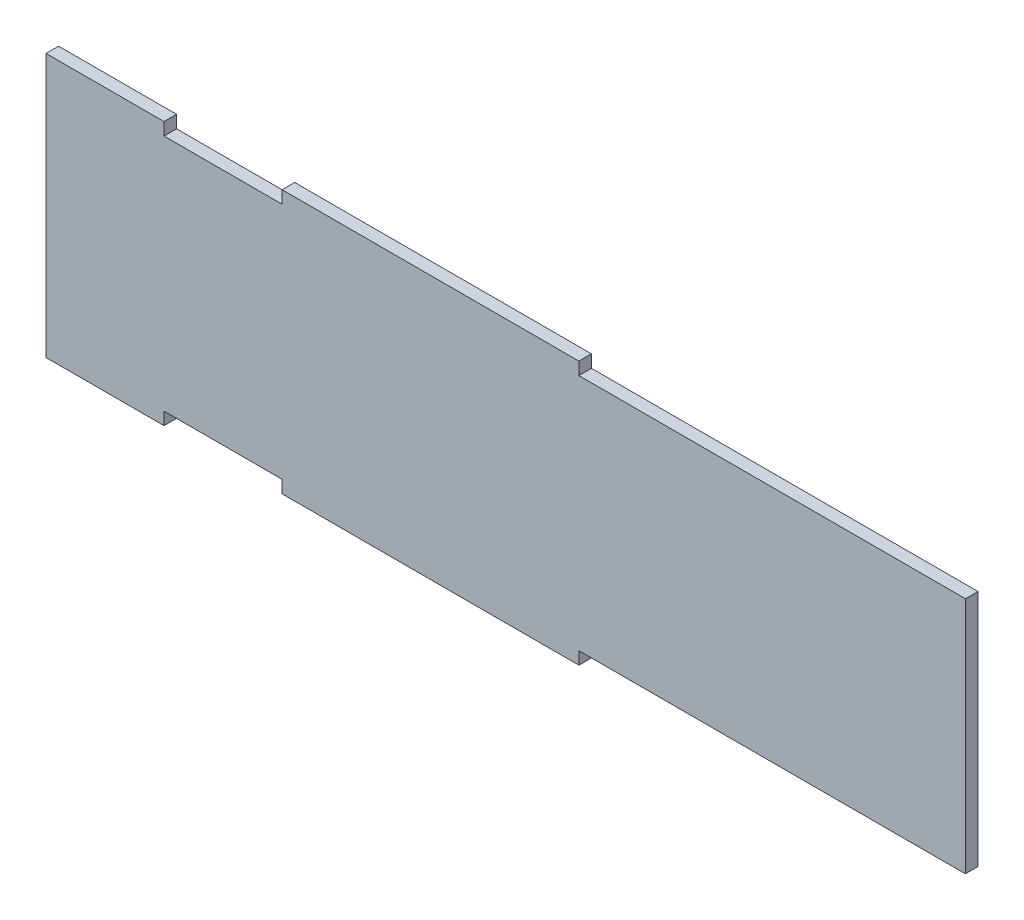
from build123d import *

# Parameters (mm, degrees)
BOSS_EXTRUDE1_DEPTH = 5.4102


with BuildPart() as part:
    # Sketch1 → Boss-Extrude1 (new body)
    with BuildSketch(Plane.XY):
        Polygon((-197.866, -56.680227), (-147.066, -56.680227), (-147.066, -51.270027), (-96.266, -51.270027), (-96.266, -56.680227), (31.496, -56.680227), (31.496, -51.270027), (197.866, -51.270027), (197.866, 51.270027), (31.496, 51.270027), (31.496, 56.680227), (-96.266, 56.680227), (-96.266, 51.270027), (-147.066, 51.270027), (-147.066, 56.680227), (-197.866, 56.680227), align=None)
    extrude(amount=BOSS_EXTRUDE1_DEPTH)


solid = part.part
